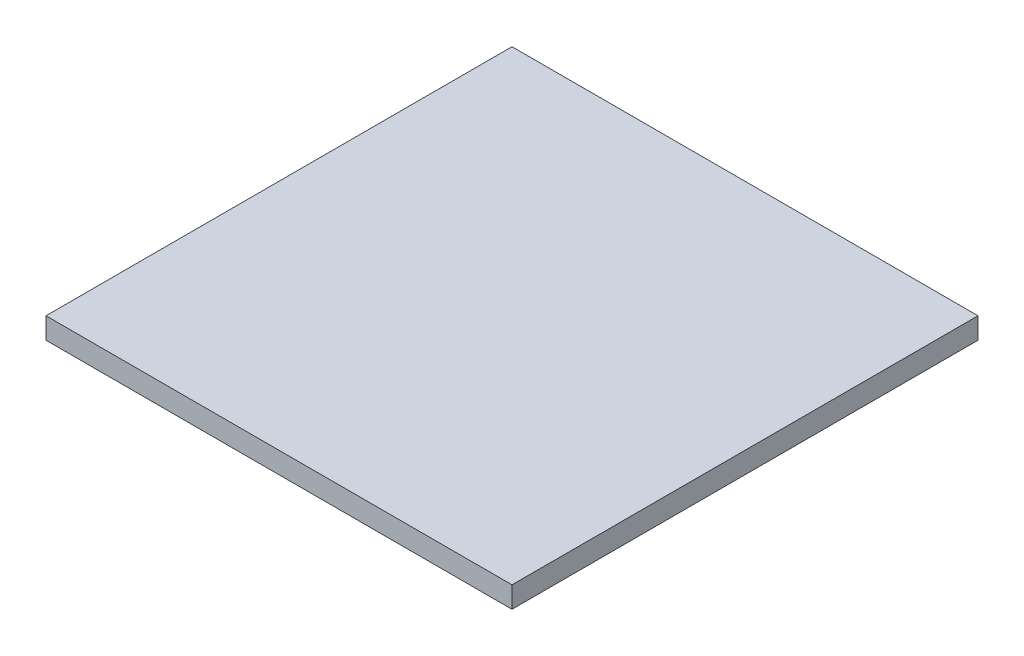
from build123d import *

# Parameters (mm, degrees)
SKETCH1_W           = 10
SKETCH1_H           = 10
BOSS_EXTRUDE1_DEPTH = 0.455


with BuildPart() as part:
    # Sketch1 → Boss-Extrude1 (new body)
    with BuildSketch(Plane(origin=(0, 0, 0), x_dir=(1, 0, 0), z_dir=(0, 1, 0))):
        with Locations((5, 5)):
            Rectangle(SKETCH1_W, SKETCH1_H)
    extrude(amount=BOSS_EXTRUDE1_DEPTH)


solid = part.part
